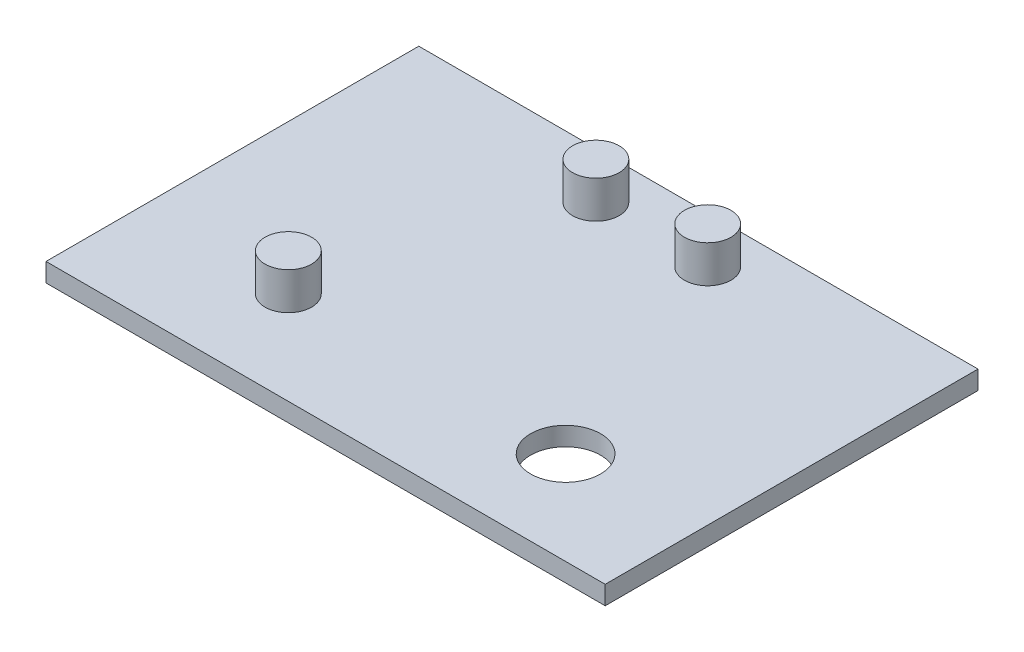
from build123d import *

# Parameters (mm, degrees)
SKETCH1_W               = 60
SKETCH1_H               = 20
BOSS_EXTRUDE1_DEPTH     = 2
SKETCH2_R               = 2.5
BOSS_EXTRUDE2_DEPTH     = 4
SKETCH3_R               = 1
BOSS_EXTRUDE3_DEPTH     = 4
CUT_EXTRUDE1_DEPTH      = 10
CUT_EXTRUDE1_DEPTH_BACK = 10
SKETCH4_R               = 3.75
SKETCH5_W               = 60
SKETCH5_H               = 20
BOSS_EXTRUDE4_DEPTH     = 2
SKETCH6_R               = 2.5
BOSS_EXTRUDE5_DEPTH     = 4


with BuildPart() as part:
    # Sketch1 → Boss-Extrude1 (new body)
    with BuildSketch(Plane(origin=(0, 0, 0), x_dir=(1, 0, 0), z_dir=(0, 1, 0))):
        Rectangle(SKETCH1_W, SKETCH1_H)
    extrude(amount=BOSS_EXTRUDE1_DEPTH)

    # Sketch2 → Boss-Extrude2 (add)
    with BuildSketch(Plane(origin=(0, 2, 0), x_dir=(1, 0, 0), z_dir=(0, 1, 0))):
        with Locations(Location((-14, 0, 0), (0, 0, 270))):
            Circle(SKETCH2_R)
    extrude(amount=BOSS_EXTRUDE2_DEPTH)

    # Sketch3 → Boss-Extrude3 (add)
    with BuildSketch(Plane(origin=(0, 2, 0), x_dir=(1, 0, 0), z_dir=(0, 1, 0))):
        with Locations(Location((15.75, 0, 0), (0, 0, 270))):
            Circle(SKETCH3_R)
    extrude(amount=BOSS_EXTRUDE3_DEPTH)

    # Sketch4 → Cut-Extrude1 (cut, two sides: drawn at the far end of the back side and taken through both)
    with BuildSketch(Plane(origin=(0, 2, 0), x_dir=(1, 0, 0), z_dir=(0, 1, 0)).offset(-CUT_EXTRUDE1_DEPTH_BACK)):
        with Locations(Location((15.75, 0, 0), (0, 0, 270))):
            Circle(SKETCH4_R)
    extrude(amount=CUT_EXTRUDE1_DEPTH + CUT_EXTRUDE1_DEPTH_BACK, mode=Mode.SUBTRACT)

    # Sketch5 → Boss-Extrude4 (add)
    with BuildSketch(Plane(origin=(0, 2, 0), x_dir=(1, 0, 0), z_dir=(0, 1, 0))):
        with Locations((0, 20)):
            Rectangle(SKETCH5_W, SKETCH5_H)
    extrude(amount=-BOSS_EXTRUDE4_DEPTH)

    # Sketch6 → Boss-Extrude5 (add)
    with BuildSketch(Plane(origin=(0, 2, 0), x_dir=(1, 0, 0), z_dir=(0, 1, 0))):
        with Locations(Location((-6, 25, 0), (0, 0, 270))):
            Circle(SKETCH6_R)
        with Locations(Location((6, 25, 0), (0, 0, 270))):
            Circle(SKETCH6_R)
    extrude(amount=BOSS_EXTRUDE5_DEPTH)


solid = part.part
